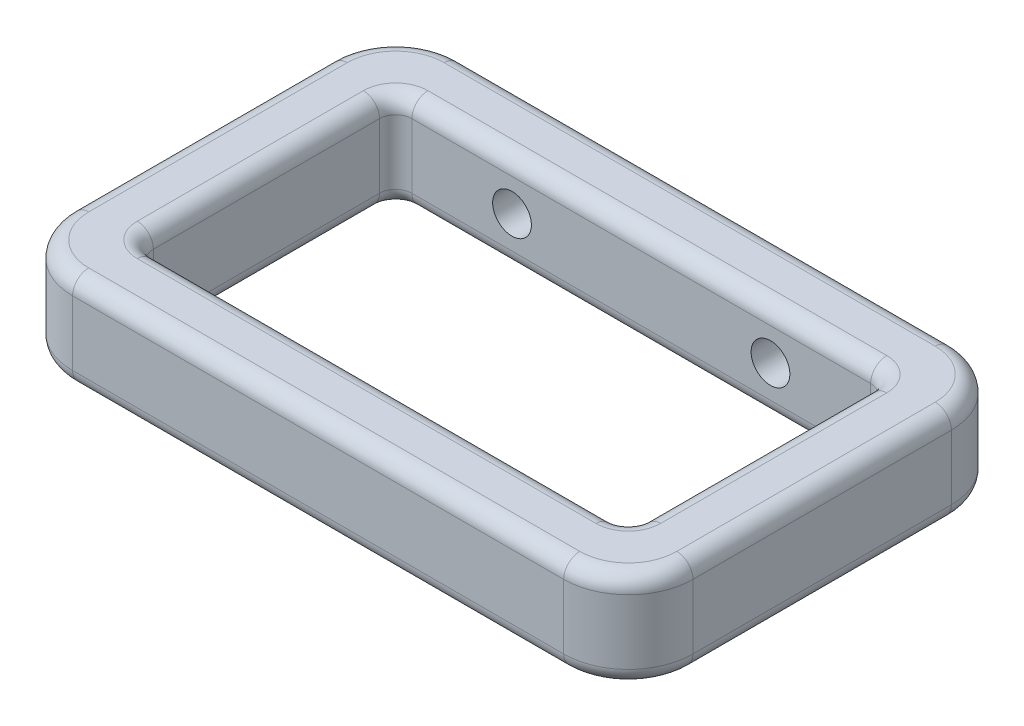
from build123d import *

# Parameters (mm, degrees)
SKETCH1_W           = 60.96
SKETCH1_H           = 38.1
SKETCH1_W_2         = 48.26
SKETCH1_H_2         = 25.4
BOSS_EXTRUDE1_DEPTH = 9.525
SKETCH2_R           = 1.905
CUT_EXTRUDE1_DEPTH  = 64.883019849
FILLET1_R           = 6.35
FILLET2_R           = 1.5875


with BuildPart() as part:
    # Sketch1 → Boss-Extrude1 (new body)
    with BuildSketch(Plane(origin=(0, 0, 0), x_dir=(1, 0, 0), z_dir=(0, 1, 0))):
        with Locations((-24.13, -12.7)):
            Rectangle(SKETCH1_W, SKETCH1_H)
        with Locations((-24.13, -12.7)):
            Rectangle(SKETCH1_W_2, SKETCH1_H_2, mode=Mode.SUBTRACT)
    extrude(amount=BOSS_EXTRUDE1_DEPTH)

    # Sketch2 → Cut-Extrude1 (cut, through all)
    with BuildSketch(Plane.XY):
        with Locations((-36.83, 4.7625)):
            Circle(SKETCH2_R)
        with Locations((-11.43, 4.7625)):
            Circle(SKETCH2_R)
    extrude(amount=-CUT_EXTRUDE1_DEPTH, mode=Mode.SUBTRACT)

    # Fillet1
    fillet1_edges = [part.edges().sort_by_distance(p)[0] for p in [
        (-54.61, 4.7625, -6.35),
        (6.35, 4.7625, -6.35),
        (6.35, 4.7625, 31.75),
        (-54.61, 4.7625, 31.75),
    ]]
    fillet(fillet1_edges, radius=FILLET1_R)

    # Fillet2
    fillet2_edges = [part.edges().sort_by_distance(p)[0] for p in [
        (0, 0, 12.7),
        (0, 4.7625, 25.4),
        (-24.13, 0, 0),
        (0, 4.7625, 0),
        (-48.26, 0, 12.7),
        (-48.26, 4.7625, 0),
        (-24.13, 0, 25.4),
        (-48.26, 4.7625, 25.4),
        (0, 9.525, 12.7),
        (-24.13, 9.525, 0),
        (-48.26, 9.525, 12.7),
        (-24.13, 9.525, 25.4),
        (-24.13, 0, 31.75),
        (-24.13, 9.525, 31.75),
        (-54.61, 0, 12.7),
        (-24.13, 0, -6.35),
        (6.35, 0, 12.7),
        (4.490128061, 0, 29.890128061),
        (4.490128061, 0, -4.490128061),
        (-52.750128061, 0, -4.490128061),
        (-52.750128061, 0, 29.890128061),
        (-54.61, 9.525, 12.7),
        (6.35, 9.525, 12.7),
        (-24.13, 9.525, -6.35),
        (4.490128061, 9.525, 29.890128061),
        (4.490128061, 9.525, -4.490128061),
        (-52.750128061, 9.525, -4.490128061),
        (-52.750128061, 9.525, 29.890128061),
    ]]
    fillet(fillet2_edges, radius=FILLET2_R)


solid = part.part
